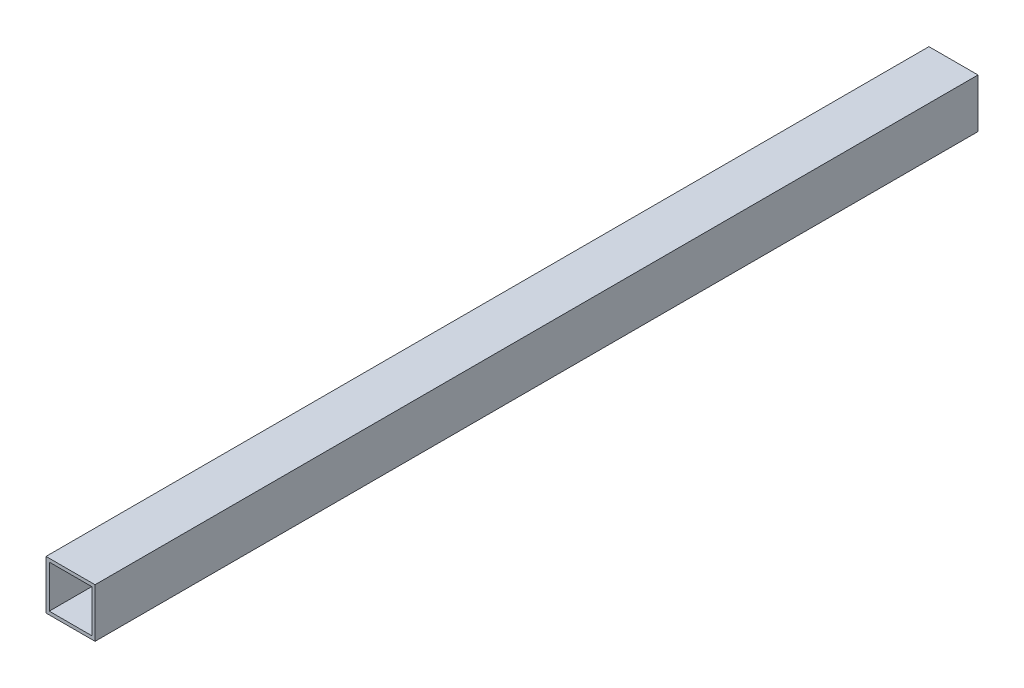
from build123d import *

# Parameters (mm, degrees)
SKETCH1_W           = 15
SKETCH1_H           = 15
SKETCH1_W_2         = 13
SKETCH1_H_2         = 13
BOSS_EXTRUDE1_DEPTH = 270


with BuildPart() as part:
    # Sketch1 → Boss-Extrude1 (new body)
    with BuildSketch(Plane.XY):
        Rectangle(SKETCH1_W, SKETCH1_H)
        Rectangle(SKETCH1_W_2, SKETCH1_H_2, mode=Mode.SUBTRACT)
    extrude(amount=BOSS_EXTRUDE1_DEPTH)


solid = part.part
